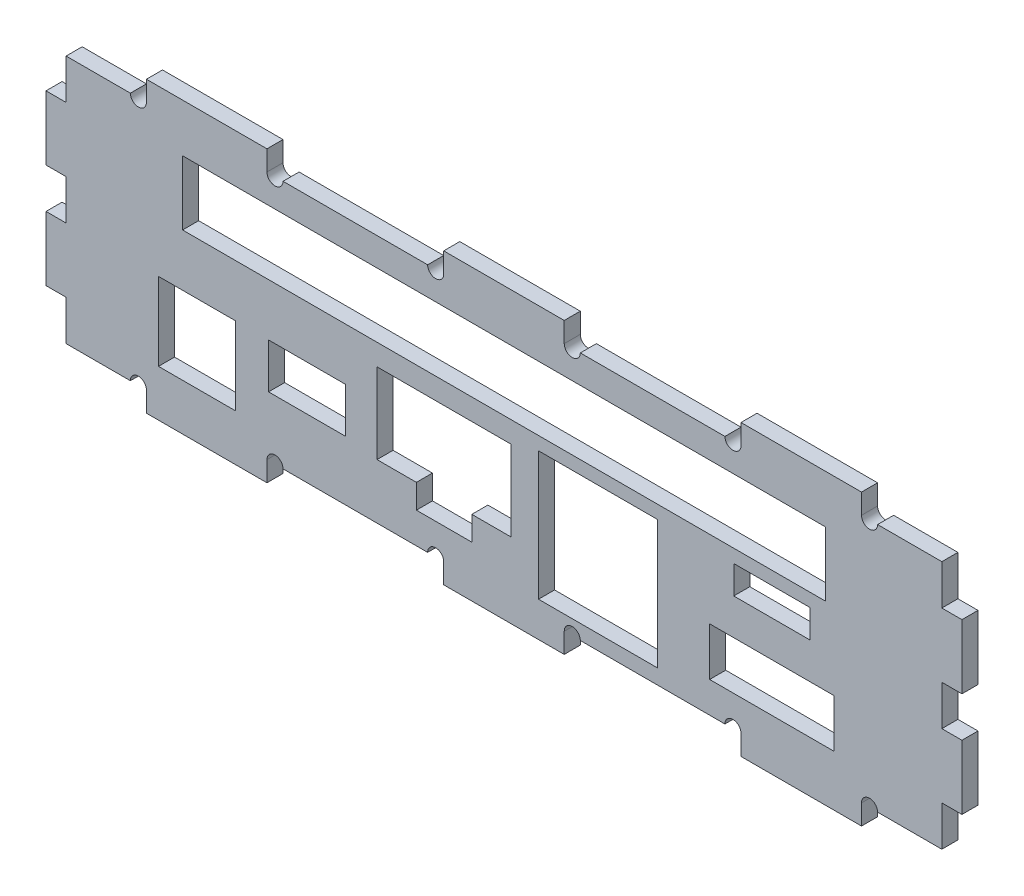
from build123d import *

# Parameters (mm, degrees)
SKETCH_1_W          = 109
SKETCH_1_H          = 31
SKETCH_1_W_2        = 9.6
SKETCH_1_H_2        = 9.7
SKETCH_1_H_3        = 5.6
SKETCH_1_W_3        = 14.8
SKETCH_1_H_4        = 16
SKETCH_1_W_4        = 9.5
SKETCH_1_H_5        = 3.5
SKETCH_1_W_5        = 15.5
SKETCH_1_H_6        = 6
SKETCH_1_W_6        = 80
SKETCH_1_H_7        = 8
EXTRUDE_1_DEPTH     = 2
SKETCH_2_W          = 2.5
SKETCH_2_H          = 8
EXTRUDE_2_DEPTH     = 2
SKETCH_3_W          = 15
SKETCH_3_H          = 2.5
EXTRUDE_4_DEPTH     = 2
CUT_EXTRUDE_2_DEPTH = 2


with BuildPart() as part:
    # 草图1 → 凸台-拉伸1 (new body)
    with BuildSketch(Plane.XY):
        with Locations((43, 12.2)):
            Rectangle(SKETCH_1_W, SKETCH_1_H)
        Polygon((27.2, 3.55), (32.1, 3.55), (32.1, 0.55), (39, 0.55), (39, 3.55), (43.9, 3.55), (43.9, 13.55), (27.2, 13.55), align=None, mode=Mode.SUBTRACT)
        with Locations((4.8, 4.85)):
            Rectangle(SKETCH_1_W_2, SKETCH_1_H_2, mode=Mode.SUBTRACT)
        with Locations((18.5, 6.9)):
            Rectangle(SKETCH_1_W_2, SKETCH_1_H_3, mode=Mode.SUBTRACT)
        with Locations((54.7, 6.55)):
            Rectangle(SKETCH_1_W_3, SKETCH_1_H_4, mode=Mode.SUBTRACT)
        with Locations((76.35, 12.8)):
            Rectangle(SKETCH_1_W_4, SKETCH_1_H_5, mode=Mode.SUBTRACT)
        with Locations((76.35, 3.55)):
            Rectangle(SKETCH_1_W_5, SKETCH_1_H_6, mode=Mode.SUBTRACT)
        with Locations((43, 20.2)):
            Rectangle(SKETCH_1_W_6, SKETCH_1_H_7, mode=Mode.SUBTRACT)
    extrude(amount=EXTRUDE_1_DEPTH)

    # 草图2 → 凸台-拉伸2 (add)
    with BuildSketch(Plane.XY.offset(2)):
        with Locations((-12.75, 18.7)):
            Rectangle(SKETCH_2_W, SKETCH_2_H)
        with Locations((-12.75, 5.7)):
            Rectangle(SKETCH_2_W, SKETCH_2_H)
        with Locations((98.75, 5.7)):
            Rectangle(SKETCH_2_W, SKETCH_2_H)
        with Locations((98.75, 18.7)):
            Rectangle(SKETCH_2_W, SKETCH_2_H)
    extrude(amount=-EXTRUDE_2_DEPTH)

    # 草图3 → 凸台-拉伸4 (add)
    with BuildSketch(Plane.XY):
        with Locations((6, 28.95)):
            Rectangle(SKETCH_3_W, SKETCH_3_H)
        with Locations((43, 28.95)):
            Rectangle(SKETCH_3_W, SKETCH_3_H)
        with Locations((80, 28.95)):
            Rectangle(SKETCH_3_W, SKETCH_3_H)
        with Locations((80, -4.55)):
            Rectangle(SKETCH_3_W, SKETCH_3_H)
        with Locations((43, -4.55)):
            Rectangle(SKETCH_3_W, SKETCH_3_H)
        with Locations((6, -4.55)):
            Rectangle(SKETCH_3_W, SKETCH_3_H)
    extrude(amount=EXTRUDE_4_DEPTH)

    # 草图4 → 切除-拉伸2 (cut)
    with BuildSketch(Plane.XY):
        with BuildLine():
            Line((-3.5, 27.7), (-1.5, 27.7))
            ThreePointArc((-1.5, 27.7), (-2.5, 26.7), (-3.5, 27.7))
        make_face()
        with BuildLine():
            Line((15.5, 27.7), (13.5, 27.7))
            ThreePointArc((13.5, 27.7), (14.5, 26.7), (15.5, 27.7))
        make_face()
        with BuildLine():
            Line((33.5, 27.7), (35.5, 27.7))
            ThreePointArc((35.5, 27.7), (34.5, 26.7), (33.5, 27.7))
        make_face()
        with BuildLine():
            Line((52.5, 27.7), (50.5, 27.7))
            ThreePointArc((50.5, 27.7), (51.5, 26.7), (52.5, 27.7))
        make_face()
        with BuildLine():
            Line((70.5, 27.7), (72.5, 27.7))
            ThreePointArc((72.5, 27.7), (71.5, 26.7), (70.5, 27.7))
        make_face()
        with BuildLine():
            Line((89.5, 27.7), (87.5, 27.7))
            ThreePointArc((87.5, 27.7), (88.5, 26.7), (89.5, 27.7))
        make_face()
        with BuildLine():
            Line((89.5, -3.3), (87.5, -3.3))
            ThreePointArc((87.5, -3.3), (88.5, -2.3), (89.5, -3.3))
        make_face()
        with BuildLine():
            Line((70.5, -3.3), (72.5, -3.3))
            ThreePointArc((72.5, -3.3), (71.5, -2.3), (70.5, -3.3))
        make_face()
        with BuildLine():
            Line((52.5, -3.3), (50.5, -3.3))
            ThreePointArc((50.5, -3.3), (51.5, -2.3), (52.5, -3.3))
        make_face()
        with BuildLine():
            Line((33.5, -3.3), (35.5, -3.3))
            ThreePointArc((35.5, -3.3), (34.5, -2.3), (33.5, -3.3))
        make_face()
        with BuildLine():
            Line((15.5, -3.3), (13.5, -3.3))
            ThreePointArc((13.5, -3.3), (14.5, -2.3), (15.5, -3.3))
        make_face()
        with BuildLine():
            Line((-3.5, -3.3), (-1.5, -3.3))
            ThreePointArc((-1.5, -3.3), (-2.5, -2.3), (-3.5, -3.3))
        make_face()
    extrude(amount=CUT_EXTRUDE_2_DEPTH, mode=Mode.SUBTRACT)


solid = part.part
